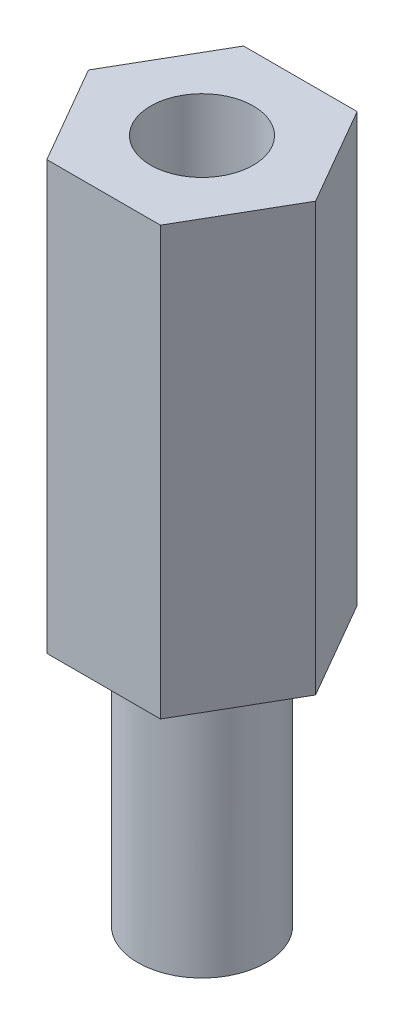
from build123d import *

# Parameters (mm, degrees)
SKETCH1_R           = 1.2
BOSS_EXTRUDE1_DEPTH = 10
SKETCH3_R           = 1.5
BOSS_EXTRUDE2_DEPTH = 6


with BuildPart() as part:
    # Sketch1 → Boss-Extrude1 (new body)
    with BuildSketch(Plane(origin=(0, 0, 0), x_dir=(1, 0, 0), z_dir=(0, 1, 0))):
        Polygon((2.655811238, 0), (1.327905619, 2.3), (-1.327905619, 2.3), (-2.655811238, 0), (-1.327905619, -2.3), (1.327905619, -2.3), align=None)
        with Locations(Location((0, 0, 0), (0, 0, 270))):
            Circle(SKETCH1_R, mode=Mode.SUBTRACT)
    extrude(amount=BOSS_EXTRUDE1_DEPTH)

    # Sketch3 → Boss-Extrude2 (add)
    with BuildSketch(Plane(origin=(0, 0, 0), x_dir=(-1, 0, 0), z_dir=(0, -1, 0))):
        with Locations(Location((0, 0, 0), (0, 0, 270))):
            Circle(SKETCH3_R)
    extrude(amount=BOSS_EXTRUDE2_DEPTH)


solid = part.part
